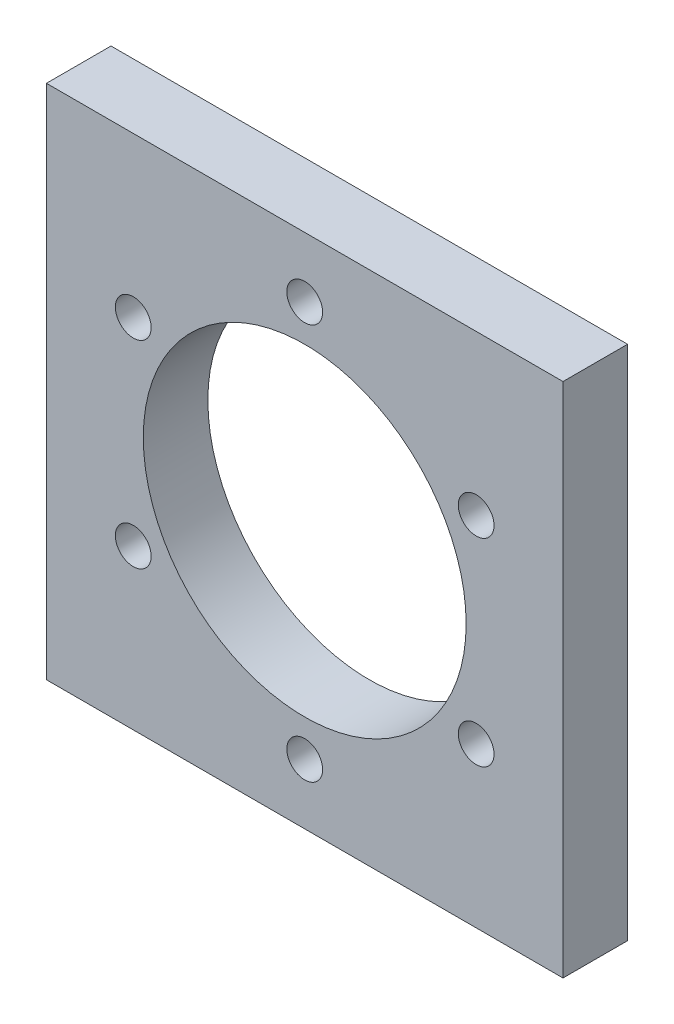
from build123d import *

# Parameters (mm, degrees)
SKETCH1_W           = 50.8
SKETCH1_H           = 50.8
SKETCH1_R           = 15.875
BOSS_EXTRUDE1_DEPTH = 6.35


with BuildPart() as part:
    # Sketch1 → Boss-Extrude1 (new body)
    with BuildSketch(Plane.XY):
        with Locations((19.355037388, 24.095046544)):
            Rectangle(SKETCH1_W, SKETCH1_H)
        with Locations((19.355037388, 24.095046544)):
            Circle(SKETCH1_R, mode=Mode.SUBTRACT)
        with BuildLine():
            ThreePointArc((34.45579594, 14.360477203), (36.215806077, 12.600467066), (37.975816214, 14.360477203))
            ThreePointArc((37.975816214, 14.360477203), (36.215806077, 16.12048734), (34.45579594, 14.360477203))
        make_face(mode=Mode.SUBTRACT)
        with BuildLine():
            ThreePointArc((21.115047525, 4.625907862), (19.355037388, 6.385917999), (17.595027251, 4.625907862))
            ThreePointArc((17.595027251, 4.625907862), (19.355037388, 2.865897725), (21.115047525, 4.625907862))
        make_face(mode=Mode.SUBTRACT)
        with BuildLine():
            ThreePointArc((17.595027251, 43.564185227), (19.355037388, 41.80417509), (21.115047525, 43.564185227))
            ThreePointArc((21.115047525, 43.564185227), (19.355037388, 45.324195364), (17.595027251, 43.564185227))
        make_face(mode=Mode.SUBTRACT)
        with BuildLine():
            ThreePointArc((37.975816214, 33.829615886), (36.215806077, 35.589626023), (34.45579594, 33.829615886))
            ThreePointArc((34.45579594, 33.829615886), (36.215806077, 32.069605749), (37.975816214, 33.829615886))
        make_face(mode=Mode.SUBTRACT)
        with BuildLine():
            ThreePointArc((0.734258563, 33.829615886), (2.494268699, 32.069605749), (4.254278836, 33.829615886))
            ThreePointArc((4.254278836, 33.829615886), (2.494268699, 35.589626023), (0.734258563, 33.829615886))
        make_face(mode=Mode.SUBTRACT)
        with BuildLine():
            ThreePointArc((4.254278836, 14.360477203), (2.494268699, 16.12048734), (0.734258563, 14.360477203))
            ThreePointArc((0.734258563, 14.360477203), (2.494268699, 12.600467066), (4.254278836, 14.360477203))
        make_face(mode=Mode.SUBTRACT)
    extrude(amount=BOSS_EXTRUDE1_DEPTH)


solid = part.part
